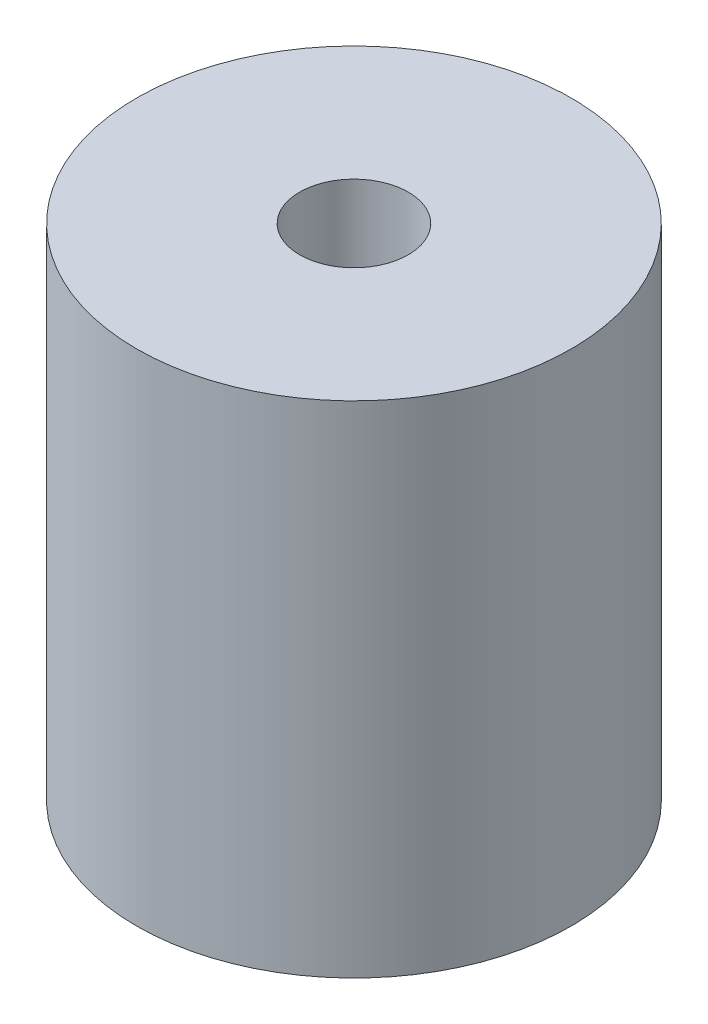
from build123d import *

# Parameters (mm, degrees)
CROQUIS2_R              = 10
CROQUIS2_R_2            = 2.5
SALIENTE_EXTRUIR1_DEPTH = 23


with BuildPart() as part:
    # Croquis2 → Saliente-Extruir1 (new body)
    with BuildSketch(Plane(origin=(0, 0, 0), x_dir=(1, 0, 0), z_dir=(0, 1, 0))):
        with Locations(Location((0, 0, 0), (0, 0, 270))):
            Circle(CROQUIS2_R)
        with Locations(Location((0, 0, 0), (0, 0, 270))):
            Circle(CROQUIS2_R_2, mode=Mode.SUBTRACT)
    extrude(amount=SALIENTE_EXTRUIR1_DEPTH)


solid = part.part
